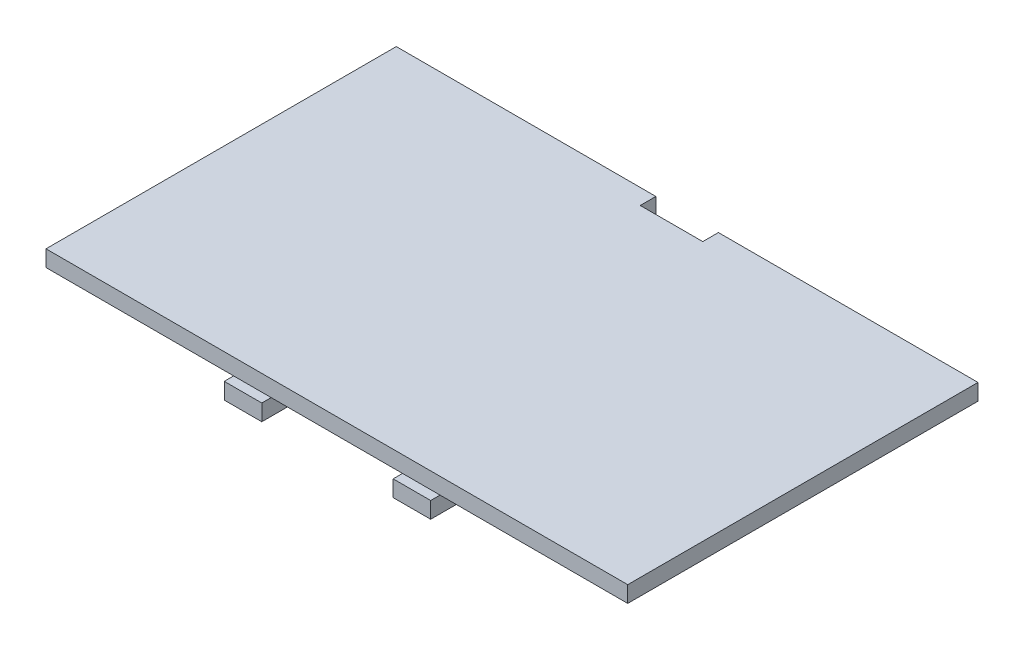
from build123d import *

# Parameters (mm, degrees)
CROQUIS1_W              = 93
CROQUIS1_H              = 56
SALIENTE_EXTRUIR1_DEPTH = 2.6
CROQUIS2_W              = 10
CROQUIS2_H              = 2.5
CORTAR_EXTRUIR1_DEPTH   = 2.6
CROQUIS3_W              = 6
CROQUIS3_H              = 1.5
CROQUIS3_H_2            = 3
SALIENTE_EXTRUIR2_DEPTH = 2.6


with BuildPart() as part:
    # Croquis1 → Saliente-Extruir1 (new body)
    with BuildSketch(Plane(origin=(0, 0, 0), x_dir=(1, 0, 0), z_dir=(0, 1, 0))):
        Rectangle(CROQUIS1_W, CROQUIS1_H)
    extrude(amount=SALIENTE_EXTRUIR1_DEPTH)

    # Croquis2 → Cortar-Extruir1 (cut)
    with BuildSketch(Plane(origin=(0, 2.6, 0), x_dir=(1, 0, 0), z_dir=(0, 1, 0))):
        with Locations((0, 26.75)):
            Rectangle(CROQUIS2_W, CROQUIS2_H)
    extrude(amount=-CORTAR_EXTRUIR1_DEPTH, mode=Mode.SUBTRACT)

    # Croquis3 → Saliente-Extruir2 (add)
    with BuildSketch(Plane.XZ):
        with Locations((13.5, 28.75)):
            Rectangle(CROQUIS3_W, CROQUIS3_H)
        with Locations((13.5, 26.5)):
            Rectangle(CROQUIS3_W, CROQUIS3_H_2)
        with Locations((-13.5, 28.75)):
            Rectangle(CROQUIS3_W, CROQUIS3_H)
        with Locations((-13.5, 26.5)):
            Rectangle(CROQUIS3_W, CROQUIS3_H_2)
    extrude(amount=SALIENTE_EXTRUIR2_DEPTH)


solid = part.part
